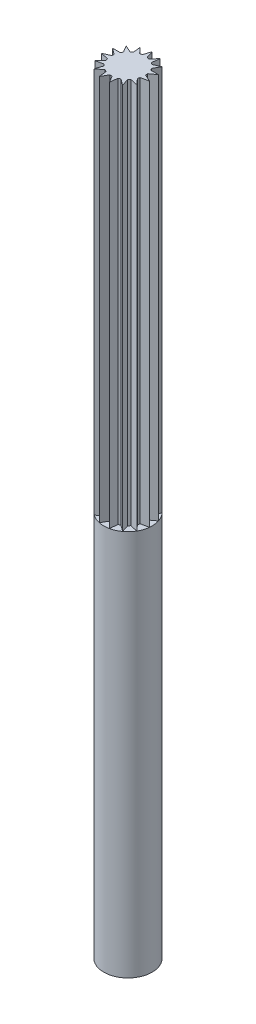
from build123d import *

# Parameters (mm, degrees)
SKETCH1_W           = 5
SKETCH1_H           = 80
BOSS_EXTRUDE1_DEPTH = 80


with BuildPart() as part:
    # Sketch1 → Revolve1 (revolve)
    with BuildSketch(Plane.XY, mode=Mode.PRIVATE) as revolve1_sk:
        with Locations((-2.5, -40)):
            Rectangle(SKETCH1_W, SKETCH1_H)
    revolve(revolve1_sk.sketch.rotate(Axis((0, 80, 0), (0, -1, 0)), 270), axis=Axis((0, 80, 0), (0, -1, 0)))

    # Sketch2 → Boss-Extrude1 (add)
    with BuildSketch(Plane(origin=(0, 0, 0), x_dir=(1, 0, 0), z_dir=(0, 1, 0))):
        with BuildLine():
            Line((-0.5, 3.464101615), (0, 5))
            Line((0, 5), (0.5, 3.464101615))
            ThreePointArc((0.5, 3.464101615), (0.727690918, 3.423516603), (0.952204333, 3.367982617))
            Line((0.952204333, 3.367982617), (2.033683215, 4.567727288))
            Line((2.033683215, 4.567727288), (1.865749791, 2.961245974))
            ThreePointArc((1.865749791, 2.961245974), (2.057248383, 2.83155948), (2.239763887, 2.689508827))
            Line((2.239763887, 2.689508827), (3.715724127, 3.345653032))
            Line((3.715724127, 3.345653032), (2.908894493, 1.946364001))
            ThreePointArc((2.908894493, 1.946364001), (3.031088913, 1.75), (3.140047917, 1.545994527))
            Line((3.140047917, 1.545994527), (4.755282581, 1.545084972))
            Line((4.755282581, 1.545084972), (3.449064911, 0.594938011))
            ThreePointArc((3.449064911, 0.594938011), (3.480826634, 0.365849621), (3.497389136, 0.135163729))
            Line((3.497389136, 0.135163729), (4.972609477, -0.522642316))
            Line((4.972609477, -0.522642316), (3.392860672, -0.859358166))
            ThreePointArc((3.392860672, -0.859358166), (3.328697807, -1.08155948), (3.25, -1.299038106))
            Line((3.25, -1.299038106), (4.330127019, -2.5))
            Line((4.330127019, -2.5), (2.75, -2.165063509))
            ThreePointArc((2.75, -2.165063509), (2.601006889, -2.341957122), (2.440656339, -2.508624451))
            Line((2.440656339, -2.508624451), (2.938926261, -4.045084972))
            Line((2.938926261, -4.045084972), (1.631639345, -3.096409703))
            ThreePointArc((1.631639345, -3.096409703), (1.423578251, -3.197409102), (1.209301024, -3.284446838))
            Line((1.209301024, -3.284446838), (1.039558454, -4.890738004))
            Line((1.039558454, -4.890738004), (0.231153424, -3.492358529))
            ThreePointArc((0.231153424, -3.492358529), (0, -3.5), (-0.231153424, -3.492358529))
            Line((-0.231153424, -3.492358529), (-1.039558454, -4.890738004))
            Line((-1.039558454, -4.890738004), (-1.209301024, -3.284446838))
            ThreePointArc((-1.209301024, -3.284446838), (-1.423578251, -3.197409102), (-1.631639345, -3.096409703))
            Line((-1.631639345, -3.096409703), (-2.938926261, -4.045084972))
            Line((-2.938926261, -4.045084972), (-2.440656339, -2.508624451))
            ThreePointArc((-2.440656339, -2.508624451), (-2.601006889, -2.341957122), (-2.75, -2.165063509))
            Line((-2.75, -2.165063509), (-4.330127019, -2.5))
            Line((-4.330127019, -2.5), (-3.25, -1.299038106))
            ThreePointArc((-3.25, -1.299038106), (-3.328697807, -1.08155948), (-3.392860672, -0.859358166))
            Line((-3.392860672, -0.859358166), (-4.972609477, -0.522642316))
            Line((-4.972609477, -0.522642316), (-3.497389136, 0.135163729))
            ThreePointArc((-3.497389136, 0.135163729), (-3.480826634, 0.365849621), (-3.449064911, 0.594938011))
            Line((-3.449064911, 0.594938011), (-4.755282581, 1.545084972))
            Line((-4.755282581, 1.545084972), (-3.140047917, 1.545994527))
            ThreePointArc((-3.140047917, 1.545994527), (-3.031088913, 1.75), (-2.908894493, 1.946364001))
            Line((-2.908894493, 1.946364001), (-3.715724127, 3.345653032))
            Line((-3.715724127, 3.345653032), (-2.239763887, 2.689508827))
            ThreePointArc((-2.239763887, 2.689508827), (-2.057248383, 2.83155948), (-1.865749791, 2.961245974))
            Line((-1.865749791, 2.961245974), (-2.033683215, 4.567727288))
            Line((-2.033683215, 4.567727288), (-0.952204333, 3.367982617))
            ThreePointArc((-0.952204333, 3.367982617), (-0.727690918, 3.423516603), (-0.5, 3.464101615))
        make_face()
    extrude(amount=BOSS_EXTRUDE1_DEPTH)


solid = part.part
